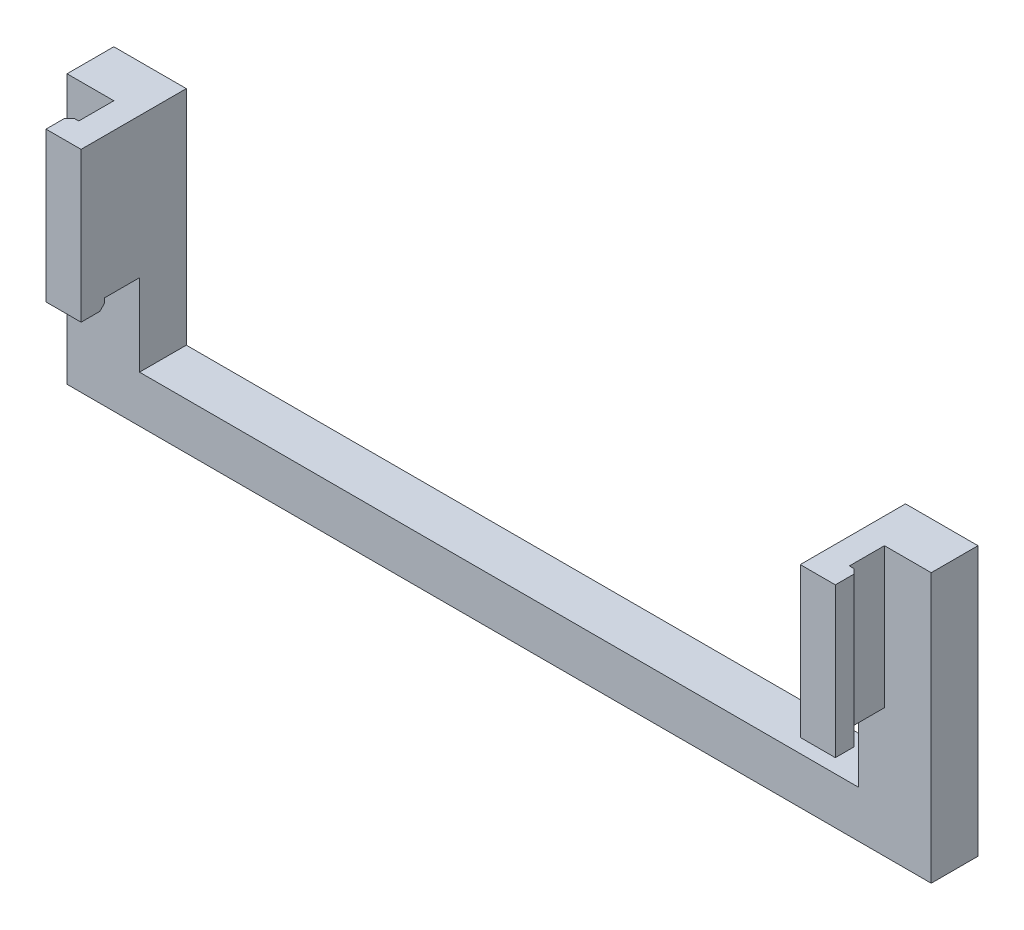
from build123d import *

# Parameters (mm, degrees)
BOSS_EXTRUDE1_DEPTH = 2
SKETCH2_W           = 1.100075991
SKETCH2_H           = 6.000695173
BOSS_EXTRUDE2_DEPTH = 1.5
SKETCH3_W           = 1.500075991
SKETCH3_H           = 6.400695173
BOSS_EXTRUDE3_DEPTH = 1
CHAMFER1_SIZE       = 0.2


with BuildPart() as part:
    # Sketch1 → Boss-Extrude1 (new body)
    with BuildSketch(Plane(origin=(0, 0, 0), x_dir=(-1, 0, 0), z_dir=(0, 0, -1))):
        Polygon((-262.955830275, 81.455427603), (-266.055906266, 81.455427603), (-266.055906266, 71.95473243), (-273.006316619, 71.95473243), (-296.80691239, 71.95473243), (-296.80691239, 81.455427603), (-299.906988381, 81.455427603), (-299.906988381, 69.95473243), (-262.955830275, 69.95473243), align=None)
    extrude(amount=BOSS_EXTRUDE1_DEPTH)

    # Sketch2 → Boss-Extrude2 (add)
    with BuildSketch(Plane.XY):
        with Locations((265.505868271, 78.455080017)):
            Rectangle(SKETCH2_W, SKETCH2_H)
        with Locations((297.356950385, 78.455080017)):
            Rectangle(SKETCH2_W, SKETCH2_H)
    extrude(amount=BOSS_EXTRUDE2_DEPTH)

    # Sketch3 → Boss-Extrude3 (add)
    with BuildSketch(Plane.XY.offset(1.5)):
        with Locations((265.305868271, 78.255080017)):
            Rectangle(SKETCH3_W, SKETCH3_H)
        with Locations((297.556950386, 78.255080017)):
            Rectangle(SKETCH3_W, SKETCH3_H)
    extrude(amount=BOSS_EXTRUDE3_DEPTH)

    # Chamfer1
    chamfer1_edges = [part.edges().sort_by_distance(p)[0] for p in [
        (264.555830275, 78.255080016, 1.5),
        (265.305868271, 75.05473243, 1.5),
        (297.556950386, 75.05473243, 1.5),
        (298.306988381, 78.255080016, 1.5),
    ]]
    chamfer(chamfer1_edges, length=CHAMFER1_SIZE)


solid = part.part
